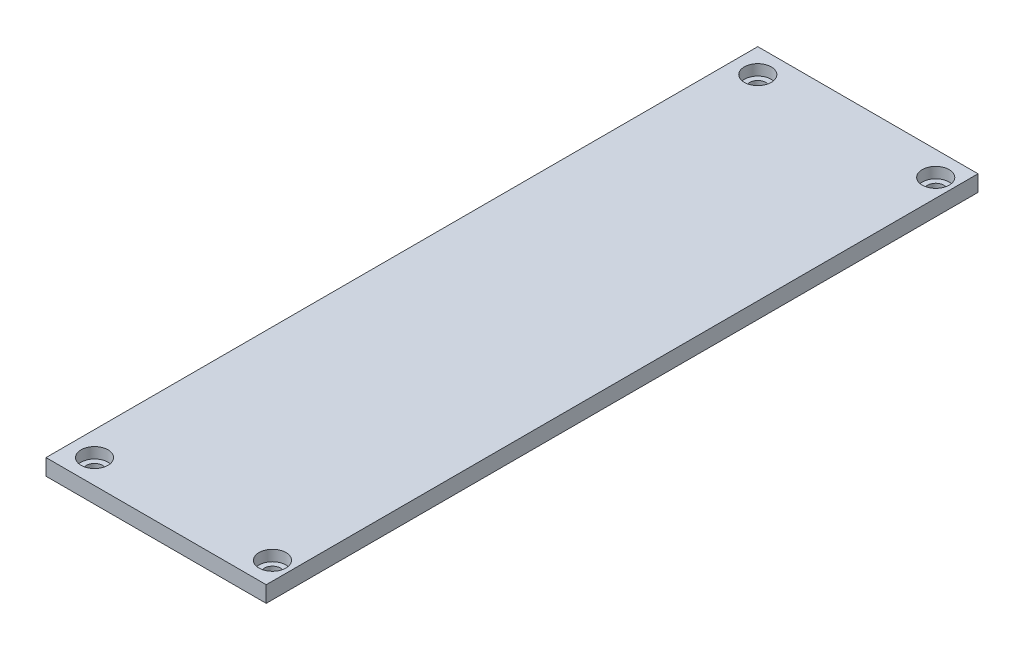
from build123d import *

# Parameters (mm, degrees)
SKETCH1_W           = 42
SKETCH1_H           = 132
BOSS_EXTRUDE1_DEPTH = 3
SKETCH2_R           = 2.5
CUT_EXTRUDE1_DEPTH  = 2
SKETCH3_R           = 1.5
CUT_EXTRUDE2_DEPTH  = 70.289248805
CUT_EXTRUDE3_DEPTH  = 70.32532005


with BuildPart() as part:
    # Sketch1 → Boss-Extrude1 (new body)
    with BuildSketch(Plane(origin=(0, 0, 0), x_dir=(1, 0, 0), z_dir=(0, 1, 0))):
        Rectangle(SKETCH1_W, SKETCH1_H)
    extrude(amount=BOSS_EXTRUDE1_DEPTH)

    # Sketch2 → Cut-Extrude1 (cut)
    with BuildSketch(Plane(origin=(0, 3, 0), x_dir=(1, 0, 0), z_dir=(0, 1, 0))):
        with Locations(Location((-16.5, 61.5, 0), (0, 0, 270))):
            Circle(SKETCH2_R)
        with Locations(Location((16.5, 61.5, 0), (0, 0, 270))):
            Circle(SKETCH2_R)
        with Locations(Location((16.5, -61.5, 0), (0, 0, 270))):
            Circle(SKETCH2_R)
        with Locations(Location((-16.5, -61.5, 0), (0, 0, 270))):
            Circle(SKETCH2_R)
    extrude(amount=-CUT_EXTRUDE1_DEPTH, mode=Mode.SUBTRACT)

    # Sketch3 → Cut-Extrude2 (cut, through all)
    with BuildSketch(Plane(origin=(0, 1, 0), x_dir=(1, 0, 0), z_dir=(0, 1, 0))):
        with Locations(Location((-16.5, 61.5, 0), (0, 0, 270))):
            Circle(SKETCH3_R)
        with Locations(Location((16.5, 61.5, 0), (0, 0, 270))):
            Circle(SKETCH3_R)
        with Locations(Location((16.5, -61.5, 0), (0, 0, 270))):
            Circle(SKETCH3_R)
        with Locations(Location((-16.5, -61.5, 0), (0, 0, 270))):
            Circle(SKETCH3_R)
    extrude(amount=-CUT_EXTRUDE2_DEPTH, mode=Mode.SUBTRACT)

    # Sketch4 → Cut-Extrude3 (cut, through all)
    with BuildSketch(Plane(origin=(0, 3, 0), x_dir=(1, 0, 0), z_dir=(0, 1, 0))):
        Polygon((21, -353.041513135), (21, -66), (21, 66), (19.84024034, 66), (19.84024034, -66), (19.84024034, -353.041513135), (19.84024034, -927.124539404), (21, -927.124539404), align=None)
    extrude(amount=-CUT_EXTRUDE3_DEPTH, mode=Mode.SUBTRACT)


solid = part.part
